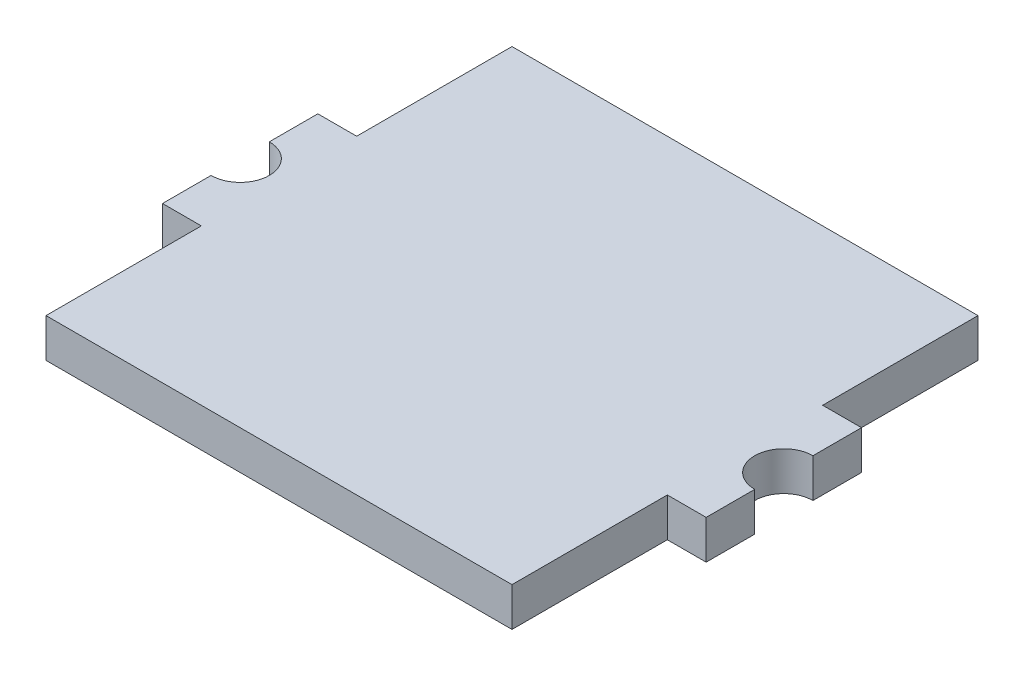
from build123d import *

# Parameters (mm, degrees)
BOSS_EXTRUDE1_DEPTH = 3.175


with BuildPart() as part:
    # Sketch1 → Boss-Extrude1 (new body)
    with BuildSketch(Plane(origin=(0, 0, 0), x_dir=(1, 0, 0), z_dir=(0, 1, 0))):
        with BuildLine():
            Line((0, 0), (0, 12.7))
            Line((0, 12.7), (-3.175, 12.7))
            Line((-3.175, 12.7), (-3.175, 16.66875))
            ThreePointArc((-3.175, 16.66875), (-0.79375, 19.05), (-3.175, 21.43125))
            Line((-3.175, 21.43125), (-3.175, 25.4))
            Line((-3.175, 25.4), (0, 25.4))
            Line((0, 25.4), (0, 38.1))
            Line((0, 38.1), (38.1, 38.1))
            Line((38.1, 38.1), (38.1, 25.4))
            Line((38.1, 25.4), (41.275, 25.4))
            Line((41.275, 25.4), (41.275, 21.43125))
            ThreePointArc((41.275, 21.43125), (38.89375, 19.05), (41.275, 16.66875))
            Line((41.275, 16.66875), (41.275, 12.7))
            Line((41.275, 12.7), (38.1, 12.7))
            Line((38.1, 12.7), (38.1, 0))
            Line((38.1, 0), (0, 0))
        make_face()
    extrude(amount=BOSS_EXTRUDE1_DEPTH)


solid = part.part
